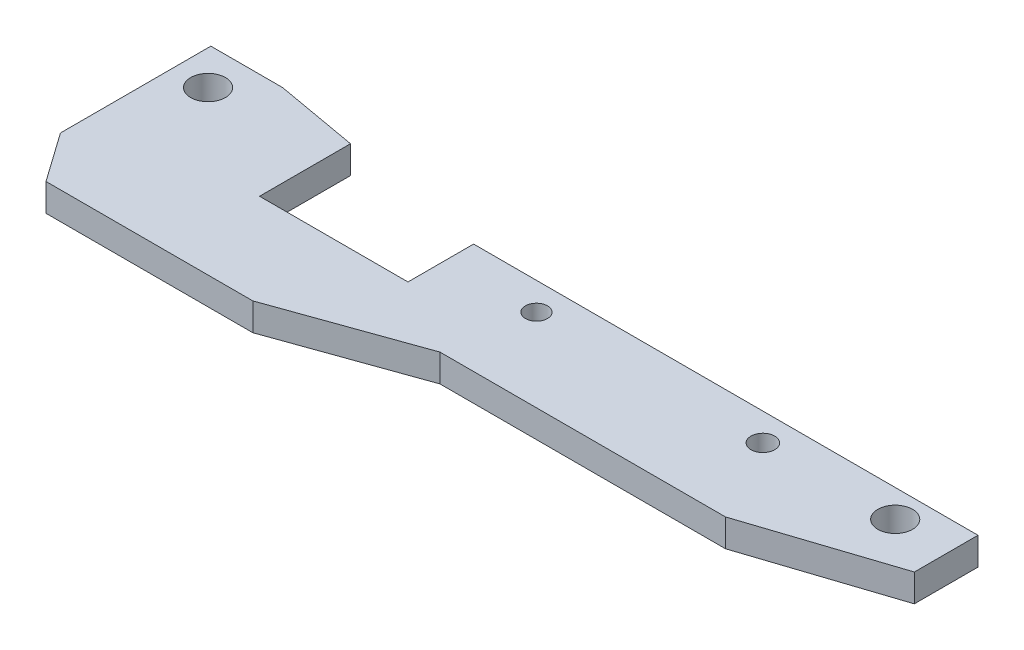
from build123d import *

# Parameters (mm, degrees)
SKETCH1_R           = 1.016
SKETCH1_R_2         = 1.600000102
SKETCH1_R_3         = 1.0922
BOSS_EXTRUDE1_DEPTH = 2.54
SKETCH2_W           = 13.66210268
SKETCH2_H           = 9.772536081
CUT_EXTRUDE1_DEPTH  = 2.54


with BuildPart() as part:
    # Sketch1 → Boss-Extrude1 (new body)
    with BuildSketch(Plane(origin=(0, 0, 0), x_dir=(1, 0, 0), z_dir=(0, 1, 0))):
        Polygon((-13.753823011, 8.752244808), (-13.753823011, 2.783244808), (-13.753823011, -5.090755192), (-10.551287224, -9.623078218), (8.47904741, -9.623078218), (21.176501094, -5.090755192), (33.876501094, -5.090755192), (47.455454133, -5.090755192), (60.541176989, -0.789612996), (60.541176989, -0.010755192), (60.541176989, 5.069244808), (37.046176989, 5.069244808), (25.616176989, 5.069244808), (13.567051989, 5.069244808), (-7.149823011, 8.752244808), align=None)
        with Locations(Location((22.441176989, 2.529244808, 0), (0, 0, 270))):
            Circle(SKETCH1_R, mode=Mode.SUBTRACT)
        with Locations(Location((55.461176989, 2.529244808, 0), (0, 0, 270))):
            Circle(SKETCH1_R_2, mode=Mode.SUBTRACT)
        with Locations(Location((-10.578823011, 5.323244808, 0), (0, 0, 270))):
            Circle(SKETCH1_R_2, mode=Mode.SUBTRACT)
        with Locations(Location((43.278107208, 2.529244808, 0), (0, 0, 270))):
            Circle(SKETCH1_R_3, mode=Mode.SUBTRACT)
    extrude(amount=BOSS_EXTRUDE1_DEPTH)

    # Sketch2 → Cut-Extrude1 (cut)
    with BuildSketch(Plane.XZ):
        with Locations((7.284233537, -3.91320906)):
            Rectangle(SKETCH2_W, SKETCH2_H)
    extrude(amount=-CUT_EXTRUDE1_DEPTH, mode=Mode.SUBTRACT)


solid = part.part
